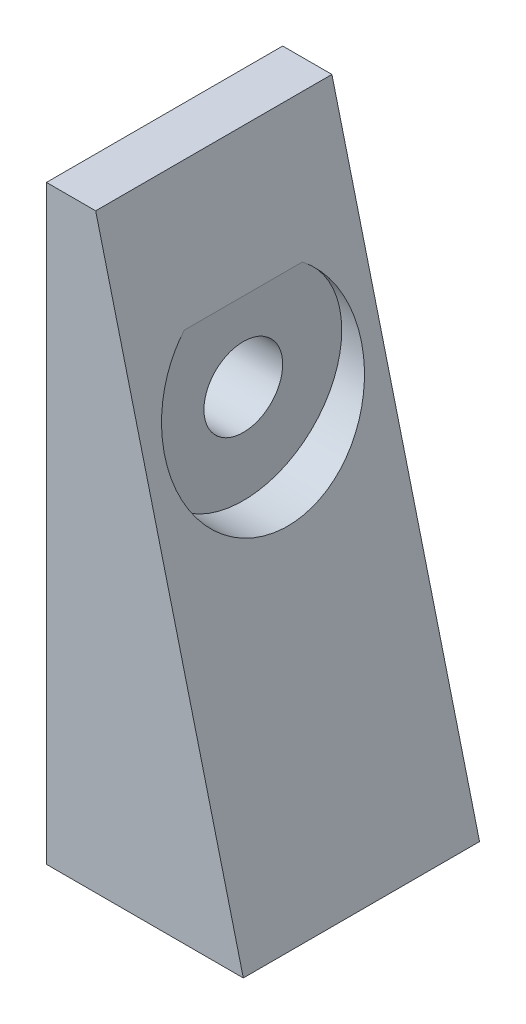
from build123d import *

# Parameters (mm, degrees)
SALIENTE_EXTRUIR1_DEPTH = 6
CROQUIS3_R              = 2
CORTAR_EXTRUIR1_DEPTH   = 33.186953879
CROQUIS5_R              = 5
CORTAR_EXTRUIR2_DEPTH   = 32.176914536


with BuildPart() as part:
    # Croquis2 → Saliente-Extruir1 (new, symmetric)
    with BuildSketch(Plane.XY):
        Polygon((0, 0), (0, 30), (2.5, 30), (10, 0), align=None)
    extrude(amount=SALIENTE_EXTRUIR1_DEPTH, both=True)

    # Croquis3 → Cortar-Extruir1 (cut, through all)
    with BuildSketch(Plane.ZY):
        with Locations((0, 20)):
            Circle(CROQUIS3_R)
    extrude(amount=-CORTAR_EXTRUIR1_DEPTH, mode=Mode.SUBTRACT)

    # Croquis5 → Cortar-Extruir2 (cut, through all)
    with BuildSketch(Plane.ZY.offset(-4)):
        with Locations((0, 20)):
            Circle(CROQUIS5_R)
    extrude(amount=-CORTAR_EXTRUIR2_DEPTH, mode=Mode.SUBTRACT)


solid = part.part
